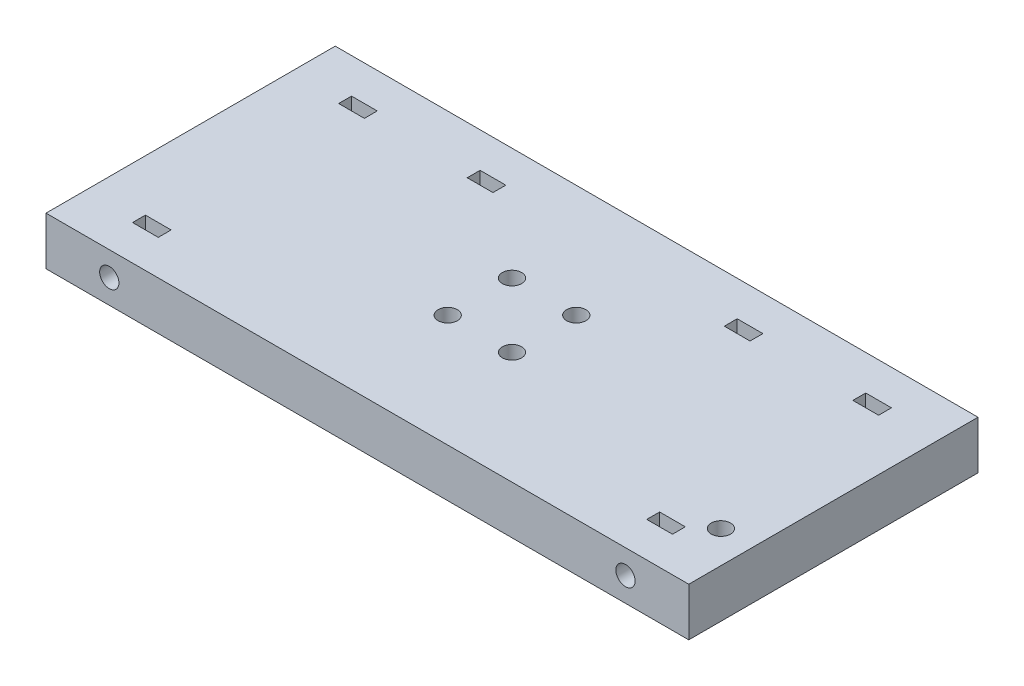
from build123d import *

# Parameters (mm, degrees)
SKETCH1_W           = 200
SKETCH1_H           = 90
SKETCH1_R           = 3
SKETCH1_W_2         = 8
SKETCH1_H_2         = 4
BOSS_EXTRUDE1_DEPTH = 15
SKETCH2_R           = 3
CUT_EXTRUDE1_DEPTH  = 20
SKETCH3_R           = 3
CUT_EXTRUDE2_DEPTH  = 20


with BuildPart() as part:
    # Sketch1 → Boss-Extrude1 (new body)
    with BuildSketch(Plane(origin=(0, 0, 0), x_dir=(1, 0, 0), z_dir=(0, 1, 0))):
        with Locations((-5.131403118, 11.792873051)):
            Rectangle(SKETCH1_W, SKETCH1_H)
        with Locations(Location((-15.131403118, 21.792873051, 0), (0, 0, 270))):
            Circle(SKETCH1_R, mode=Mode.SUBTRACT)
        with Locations(Location((-15.131403118, 1.792873051, 0), (0, 0, 90))):
            Circle(SKETCH1_R, mode=Mode.SUBTRACT)
        with Locations(Location((4.868596882, 21.792873051, 0), (0, 0, 90))):
            Circle(SKETCH1_R, mode=Mode.SUBTRACT)
        with Locations(Location((4.868596882, 1.792873051, 0), (0, 0, 270))):
            Circle(SKETCH1_R, mode=Mode.SUBTRACT)
        with Locations(Location((84.868596882, -13.207126949, 0), (0, 0, 270))):
            Circle(SKETCH1_R, mode=Mode.SUBTRACT)
        with Locations((-85.131403118, 43.860843617)):
            Rectangle(SKETCH1_W_2, SKETCH1_H_2, mode=Mode.SUBTRACT)
        with Locations((-45.131403118, 43.860843617)):
            Rectangle(SKETCH1_W_2, SKETCH1_H_2, mode=Mode.SUBTRACT)
        with Locations((34.868596882, 43.860843617)):
            Rectangle(SKETCH1_W_2, SKETCH1_H_2, mode=Mode.SUBTRACT)
        with Locations((74.868596882, 43.860843617)):
            Rectangle(SKETCH1_W_2, SKETCH1_H_2, mode=Mode.SUBTRACT)
        with Locations((74.868596882, -20.275097514)):
            Rectangle(SKETCH1_W_2, SKETCH1_H_2, mode=Mode.SUBTRACT)
        with Locations((-85.131403118, -20.275097514)):
            Rectangle(SKETCH1_W_2, SKETCH1_H_2, mode=Mode.SUBTRACT)
    extrude(amount=BOSS_EXTRUDE1_DEPTH)

    # Sketch2 → Cut-Extrude1 (cut)
    with BuildSketch(Plane(origin=(0, 0, -56.792873051), x_dir=(-1, 0, 0), z_dir=(0, 0, -1))):
        with Locations((-74.868596882, 7.5)):
            Circle(SKETCH2_R)
        with Locations((-34.868596882, 7.5)):
            Circle(SKETCH2_R)
        with Locations((45.131403118, 7.5)):
            Circle(SKETCH2_R)
        with Locations(Location((85.131403118, 7.5, 0), (0, 0, 180))):
            Circle(SKETCH2_R)
    extrude(amount=-CUT_EXTRUDE1_DEPTH, mode=Mode.SUBTRACT)

    # Sketch3 → Cut-Extrude2 (cut)
    with BuildSketch(Plane.XY.offset(33.207126949)):
        with Locations((-85.445029849, 7.5)):
            Circle(SKETCH3_R)
        with Locations((75.182223613, 7.5)):
            Circle(SKETCH3_R)
    extrude(amount=-CUT_EXTRUDE2_DEPTH, mode=Mode.SUBTRACT)


solid = part.part
